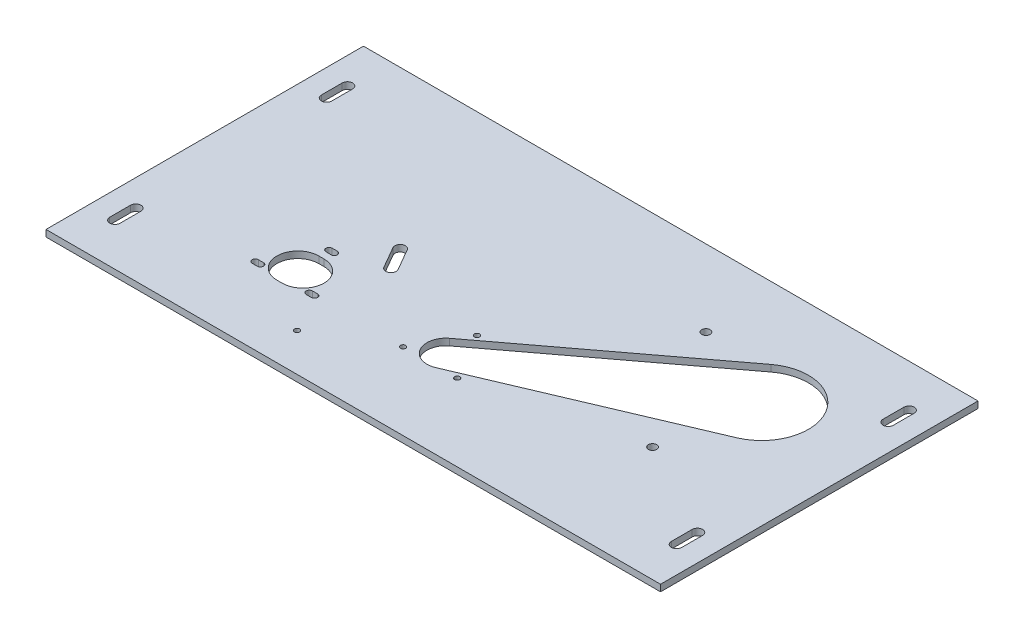
from build123d import *

# Parameters (mm, degrees)
CROQUIS1_W              = 295
CROQUIS1_H              = 152.4
SALIENTE_EXTRUIR1_DEPTH = 3.175
CROQUIS2_R              = 9
CROQUIS2_R_2            = 22.5
CROQUIS2_R_3            = 2
CROQUIS2_R_4            = 1.25
CORTAR_EXTRUIR1_DEPTH   = 3.175
CROQUIS3_R              = 1.25
CORTAR_EXTRUIR2_DEPTH   = 167.050506247


with BuildPart() as part:
    # Croquis1 → Saliente-Extruir1 (new body)
    with BuildSketch(Plane(origin=(0, 0, 0), x_dir=(1, 0, 0), z_dir=(0, 1, 0))):
        Rectangle(CROQUIS1_W, CROQUIS1_H)
    extrude(amount=SALIENTE_EXTRUIR1_DEPTH)

    # Croquis2 → Cortar-Extruir1 (cut)
    with BuildSketch(Plane(origin=(0, 3.175, 0), x_dir=(1, 0, 0), z_dir=(0, 1, 0))):
        with BuildLine():
            Line((-137.3, 55.8), (-137.3, 45.8))
            ThreePointArc((-137.3, 45.8), (-134.8, 43.3), (-132.3, 45.8))
            Line((-132.3, 45.8), (-132.3, 55.8))
            ThreePointArc((-132.3, 55.8), (-134.8, 58.3), (-137.3, 55.8))
        make_face()
        with BuildLine():
            ThreePointArc((-137.3, -45.8), (-134.8, -43.3), (-132.3, -45.8))
            Line((-132.3, -45.8), (-132.3, -55.8))
            ThreePointArc((-132.3, -55.8), (-134.8, -58.3), (-137.3, -55.8))
            Line((-137.3, -55.8), (-137.3, -45.8))
        make_face()
        with Locations((0, -31.8)):
            Circle(CROQUIS2_R)
        with Locations((96.12881982, 23.7)):
            Circle(CROQUIS2_R_2)
        with Locations(Location((53.548724126, 39.530889132, 0), (0, 0, 270))):
            Circle(CROQUIS2_R_3)
        with Locations(Location((88.548724126, -21.090889132, 0), (0, 0, 270))):
            Circle(CROQUIS2_R_3)
        with BuildLine():
            ThreePointArc((137.3, 45.8), (134.8, 43.3), (132.3, 45.8))
            Line((132.3, 45.8), (132.3, 55.8))
            ThreePointArc((132.3, 55.8), (134.8, 58.3), (137.3, 55.8))
            Line((137.3, 55.8), (137.3, 45.8))
        make_face()
        with BuildLine():
            Line((137.3, -55.8), (137.3, -45.8))
            ThreePointArc((137.3, -45.8), (134.8, -43.3), (132.3, -45.8))
            Line((132.3, -45.8), (132.3, -55.8))
            ThreePointArc((132.3, -55.8), (134.8, -58.3), (137.3, -55.8))
        make_face()
        with BuildLine():
            Line((82.592466968, 41.672677916), (-5.414541141, -24.610928834))
            ThreePointArc((-5.414541141, -24.610928834), (4.01678539, -23.746091934), (9, -31.8))
            ThreePointArc((9, -31.8), (7.505592222, -36.76649629), (3.518647689, -40.083665761))
            Line((3.518647689, -40.083665761), (104.925439043, 2.990835598))
            ThreePointArc((104.925439043, 2.990835598), (76.643248235, 12.45), (82.592466968, 41.672677916))
        make_face()
        with Locations(Location((-45.249827348, -57.925, 0), (0, 0, 270))):
            Circle(CROQUIS2_R_4)
    extrude(amount=-CORTAR_EXTRUIR1_DEPTH, mode=Mode.SUBTRACT)

    # Croquis3 → Cortar-Extruir2 (cut, through all)
    with BuildSketch(Plane(origin=(0, 3.175, 0), x_dir=(1, 0, 0), z_dir=(0, 1, 0))):
        with Locations(Location((0, -16.8, 0), (0, 0, 270))):
            Circle(CROQUIS3_R)
        with Locations(Location((12.990381057, -39.3, 0), (0, 0, 270))):
            Circle(CROQUIS3_R)
        with Locations(Location((-12.990381057, -39.3, 0), (0, 0, 270))):
            Circle(CROQUIS3_R)
        with BuildLine():
            Line((-52.334936491, 2.051152423), (-46.334936491, -8.341152423))
            ThreePointArc((-46.334936491, -8.341152423), (-47.25, -11.756215932), (-50.665063509, -10.841152423))
            Line((-50.665063509, -10.841152423), (-56.665063509, -0.448847577))
            ThreePointArc((-56.665063509, -0.448847577), (-55.75, 2.966215932), (-52.334936491, 2.051152423))
        make_face()
        with BuildLine():
            Line((-71, -15.3), (-68.5, -15.3))
            ThreePointArc((-68.5, -15.3), (-67, -16.8), (-68.5, -18.3))
            Line((-68.5, -18.3), (-71, -18.3))
            ThreePointArc((-71, -18.3), (-72.5, -16.8), (-71, -15.3))
        make_face()
        with BuildLine():
            Line((-58.009618943, -37.8), (-55.509618943, -37.8))
            ThreePointArc((-55.509618943, -37.8), (-54.009618943, -39.3), (-55.509618943, -40.8))
            Line((-55.509618943, -40.8), (-58.009618943, -40.8))
            ThreePointArc((-58.009618943, -40.8), (-59.509618943, -39.3), (-58.009618943, -37.8))
        make_face()
        with BuildLine():
            Line((-83.990381057, -37.8), (-81.490381057, -37.8))
            ThreePointArc((-81.490381057, -37.8), (-79.990381057, -39.3), (-81.490381057, -40.8))
            Line((-81.490381057, -40.8), (-83.990381057, -40.8))
            ThreePointArc((-83.990381057, -40.8), (-85.490381057, -39.3), (-83.990381057, -37.8))
        make_face()
        with BuildLine():
            Line((-71, -21.75), (-68.5, -21.75))
            ThreePointArc((-68.5, -21.75), (-58.45, -31.8), (-68.5, -41.85))
            Line((-68.5, -41.85), (-71, -41.85))
            ThreePointArc((-71, -41.85), (-81.05, -31.8), (-71, -21.75))
        make_face()
    extrude(amount=-CORTAR_EXTRUIR2_DEPTH, mode=Mode.SUBTRACT)


solid = part.part
